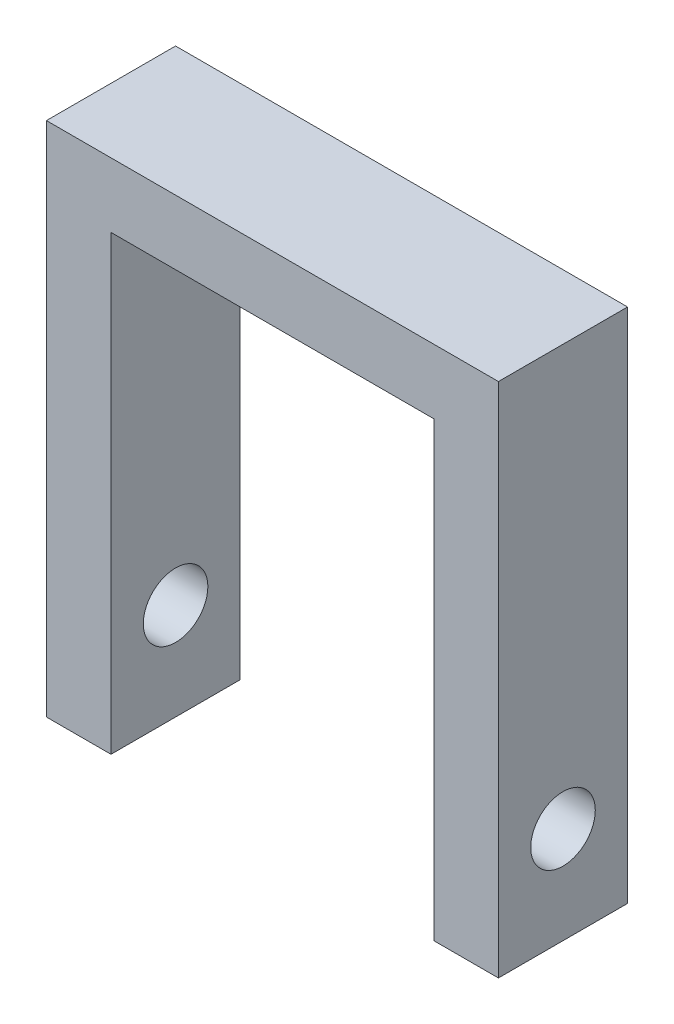
from build123d import *

# Parameters (mm, degrees)
BOSS_EXTRUDE1_DEPTH     = 20
CUT_EXTRUDE1_DEPTH      = 102.980390272
CUT_EXTRUDE1_DEPTH_BACK = 102.980390272
SKETCH2_R               = 5


with BuildPart() as part:
    # Sketch1 → Boss-Extrude1 (new body)
    with BuildSketch(Plane.XY):
        Polygon((0, 0), (0, 70), (-50, 70), (-50, 0), (-60, 0), (-60, 80), (10, 80), (10, 0), align=None)
    extrude(amount=BOSS_EXTRUDE1_DEPTH)

    # Sketch2 → Cut-Extrude1 (cut, two sides: drawn at the far end of the back side and taken through both)
    with BuildSketch(Plane.ZY.offset(-CUT_EXTRUDE1_DEPTH_BACK)):
        with Locations(Location((10, 15, 0), (0, 0, 180))):
            Circle(SKETCH2_R)
    extrude(amount=CUT_EXTRUDE1_DEPTH + CUT_EXTRUDE1_DEPTH_BACK, mode=Mode.SUBTRACT)


solid = part.part
